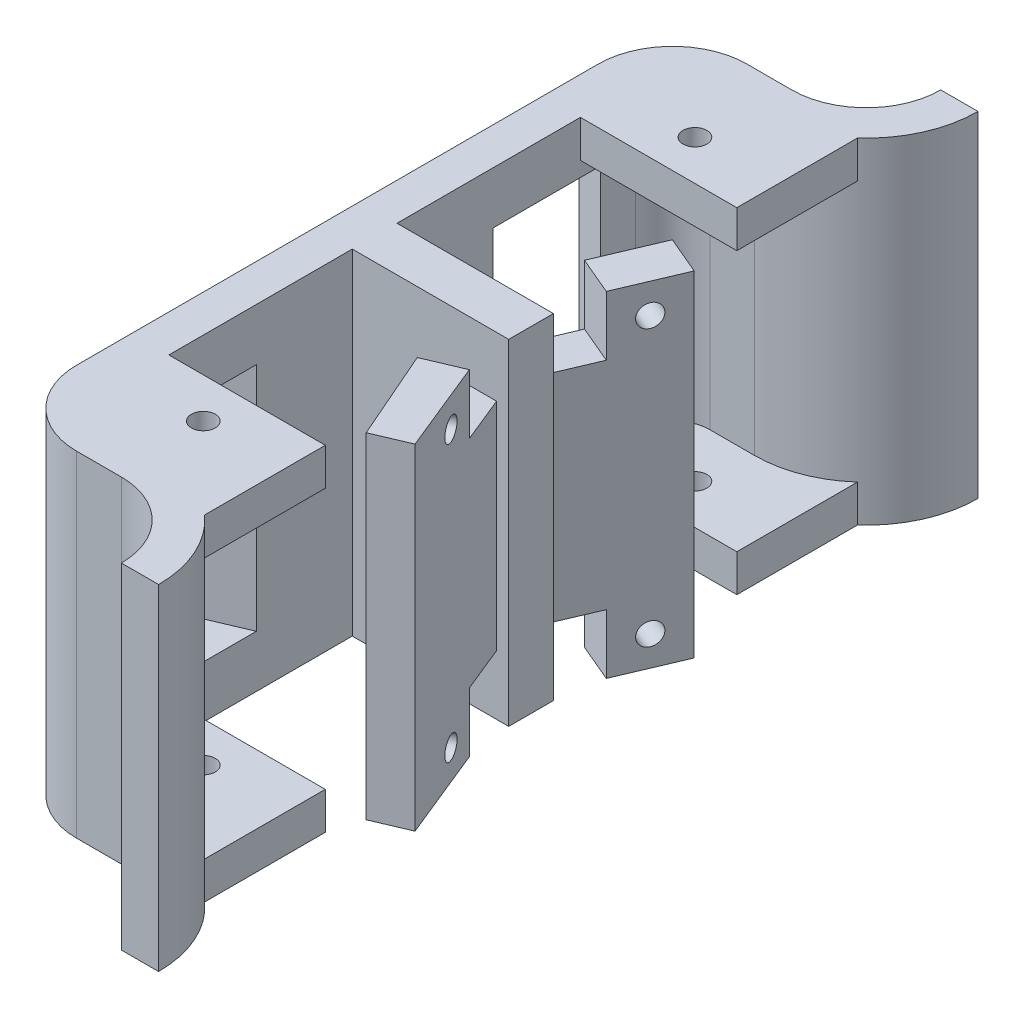
from build123d import *

# Parameters (mm, degrees)
EXTRUDE_1_DEPTH     = 45
EXTRUDE_START       = -5
EXTRUDE_2_DEPTH     = 5
SKETCH_4_W          = 56.099400369
SKETCH_4_H          = 117.099049564
CUT_EXTRUDE_1_DEPTH = 68.024249343
SKETCH_8_R          = 1.6
CUT_EXTRUDE_3_DEPTH = 78.530639105
SKETCH_10_W         = 6
SKETCH_10_H         = 45
EXTRUDE_5_DEPTH     = 26
CUT_EXTRUDE_4_DEPTH = 31
EXTRUDE_6_DEPTH     = 45
CUT_EXTRUDE_6_DEPTH = 8
CUT_EXTRUDE_7_REACH = 82.1
SKETCH_19_R         = 1.5


with BuildPart() as part:
    # 草图1 → 凸台-拉伸1 (new body)
    with BuildSketch(Plane(origin=(0, 0, 0), x_dir=(1, 0, 0), z_dir=(0, 1, 0))):
        with BuildLine():
            Line((26, 55), (31, 55))
            ThreePointArc((31, 55), (26.606601718, 44.393398282), (16, 40))
            Line((16, 40), (10, 40))
            ThreePointArc((10, 40), (6.464466094, 38.535533906), (5, 35))
            Line((5, 35), (5, -35))
            ThreePointArc((5, -35), (6.464466094, -38.535533906), (10, -40))
            Line((10, -40), (16, -40))
            ThreePointArc((16, -40), (26.606601718, -44.393398282), (31, -55))
            Line((31, -55), (26, -55))
            ThreePointArc((26, -55), (23.071067812, -47.928932188), (16, -45))
            Line((16, -45), (10, -45))
            ThreePointArc((10, -45), (2.928932188, -42.071067812), (0, -35))
            Line((0, -35), (0, 35))
            ThreePointArc((0, 35), (2.928932188, 42.071067812), (10, 45))
            Line((10, 45), (16, 45))
            ThreePointArc((16, 45), (23.071067812, 47.928932188), (26, 55))
        make_face()
    extrude_1 = extrude(amount=EXTRUDE_1_DEPTH)

    # 草图3 → 凸台-拉伸2 (add)
    with BuildSketch(Plane(origin=(0, 45, 0), x_dir=(1, 0, 0), z_dir=(0, 1, 0)).offset(EXTRUDE_START)):
        with BuildLine():
            Line((5, 27.623228275), (26, 27.623228275))
            Line((26, 27.623228275), (26, 55))
            ThreePointArc((26, 55), (23.071067812, 47.928932188), (16, 45))
            Line((16, 45), (10, 45))
            ThreePointArc((10, 45), (2.928932188, 42.071067812), (0, 35))
            Line((0, 35), (0, 27.623228275))
            Line((0, 27.623228275), (5, 27.623228275))
        make_face()
        with BuildLine():
            Line((0, -27.623228275), (5, -27.623228275))
            Line((5, -27.623228275), (26, -27.623228275))
            Line((26, -27.623228275), (26, -55))
            ThreePointArc((26, -55), (23.071067812, -47.928932188), (16, -45))
            Line((16, -45), (10, -45))
            ThreePointArc((10, -45), (2.928932188, -42.071067812), (0, -35))
            Line((0, -35), (0, -27.623228275))
        make_face()
    extrude_2 = extrude(amount=EXTRUDE_2_DEPTH)

    # 草图4 → 切除-拉伸1 (cut, through all)
    with BuildSketch(Plane(origin=(0, 22.5, 0), x_dir=(-1, 0, 0), z_dir=(0, -1, 0))):
        with Locations((-12.373979196, 0.253461146)):
            Rectangle(SKETCH_4_W, SKETCH_4_H)
    extrude(amount=CUT_EXTRUDE_1_DEPTH, mode=Mode.SUBTRACT)

    # 镜向5: 凸台-拉伸1, 凸台-拉伸2 across plane
    add(extrude_1.mirror(Plane.ZX.offset(22.5)))
    add(extrude_2.mirror(Plane.ZX.offset(22.5)))

    # 草图8 → 切除-拉伸3 (cut, through all)
    with BuildSketch(Plane(origin=(0, 0, 0), x_dir=(-1, 0, 0), z_dir=(0, -1, 0))):
        with Locations(Location((-15, 33, 0), (0, 0, 90))):
            Circle(SKETCH_8_R)
        with Locations(Location((-15, -33, 0), (0, 0, 90))):
            Circle(SKETCH_8_R)
    extrude(amount=-CUT_EXTRUDE_3_DEPTH, mode=Mode.SUBTRACT)

    # 草图10 → 凸台-拉伸5 (add)
    with BuildSketch(Plane.ZY):
        with Locations((0, 22.5)):
            Rectangle(SKETCH_10_W, SKETCH_10_H)
    extrude(amount=-EXTRUDE_5_DEPTH)

    # Sketch 2198 → 切除-拉伸4 (cut)
    with BuildSketch(Plane(origin=(0, 38, 0), x_dir=(1, 0, 0), z_dir=(0, 1, 0))):
        Polygon((0, -18), (0, -35), (21.171611629, -26.013184045), (21.171611629, -9.013184045), align=None)
        Polygon((0, 32.448593019), (0, 18), (15.97488762, 11.219062513), (21.171611629, 23.461777064), align=None)
    extrude(amount=-CUT_EXTRUDE_4_DEPTH, mode=Mode.SUBTRACT)

    # 草图15 → 凸台-拉伸6 (add)
    with BuildSketch(Plane(origin=(0, 0, 0), x_dir=(-1, 0, 0), z_dir=(0, -1, 0))):
        Polygon((-18.373024886, 3), (-24.373024886, 3), (-30.49016031, 17.411067961), (-25.406185199, 19.569087362), align=None)
        Polygon((-31.8885242, -21.464124551), (-24.373024886, -3), (-18.373024886, -3), (-27.285999932, -23.417780194), align=None)
    extrude(amount=-EXTRUDE_6_DEPTH)

    # 草图16 → 切除-拉伸6 (cut)
    with BuildSketch(Plane(origin=(0, 0, 0), x_dir=(-1, 0, 0), z_dir=(0, -1, 0))):
        Polygon((-24.373024886, -3), (-18.373024886, -3), (-21.889605043, -11.284543681), (-26.973580154, -9.12652428), align=None)
        Polygon((-18.373024886, 3), (-21.889605043, 11.284543681), (-26.973580154, 9.12652428), (-24.373024886, 3), align=None)
    cut_extrude_6 = extrude(amount=-CUT_EXTRUDE_6_DEPTH, mode=Mode.SUBTRACT)

    # 镜向6: 切除-拉伸6 across plane
    add(cut_extrude_6.mirror(Plane(origin=(0, 22.5, 0), x_dir=(0, 0, 1), z_dir=(0, -1, 0))), mode=Mode.SUBTRACT)

    # 草图19 → 切除-拉伸7 (cut, up to next)
    with BuildSketch(Plane(origin=(19.572965618, 0, 8.308230983), x_dir=(0.39073112848926966, 0, -0.9205048534524422), z_dir=(0.9205048534524422, 0, 0.39073112848926966)), mode=Mode.PRIVATE) as cut_extrude_7_sk1:
        with Locations((23.440427308, 41)):
            Circle(SKETCH_19_R)
    cut_extrude_7_tool1 = extrude(cut_extrude_7_sk1.sketch, amount=-CUT_EXTRUDE_7_REACH, mode=Mode.PRIVATE) & part.part
    # 草图19 → 切除-拉伸7 (cut, up to next)
    with BuildSketch(Plane(origin=(19.572965618, 0, 8.308230983), x_dir=(0.39073112848926966, 0, -0.9205048534524422), z_dir=(0.9205048534524422, 0, 0.39073112848926966)), mode=Mode.PRIVATE) as cut_extrude_7_sk2:
        with Locations((23.440427308, 4)):
            Circle(SKETCH_19_R)
    cut_extrude_7_tool2 = extrude(cut_extrude_7_sk2.sketch, amount=-CUT_EXTRUDE_7_REACH, mode=Mode.PRIVATE) & part.part
    cut_extrude_7_1 = cut_extrude_7_tool1.solids().sort_by_distance((28.73187, 41, -13.268796))[0]
    add(cut_extrude_7_1, mode=Mode.SUBTRACT)
    cut_extrude_7_2 = cut_extrude_7_tool2.solids().sort_by_distance((28.73187, 4, -13.268796))[0]
    add(cut_extrude_7_2, mode=Mode.SUBTRACT)
    cut_extrude_7 = cut_extrude_7_1 + cut_extrude_7_2  # 切除-拉伸7 as one shape, for the pattern or mirror that repeats it

    # 镜向7: 切除-拉伸7 across plane
    add(cut_extrude_7.mirror(Plane.XY), mode=Mode.SUBTRACT)


solid = part.part
